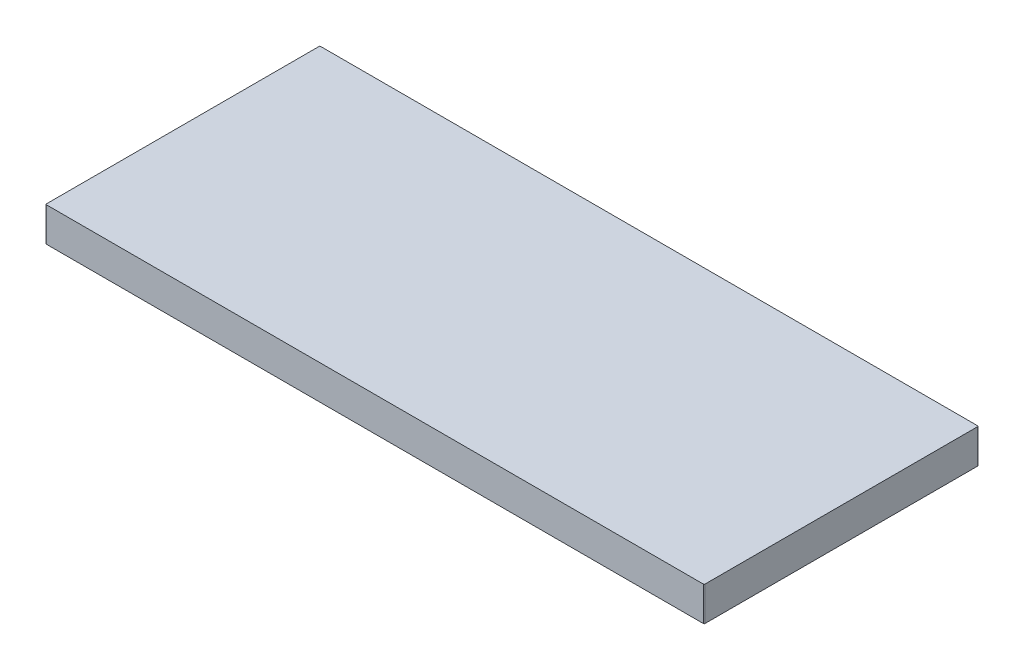
from build123d import *

# Parameters (mm, degrees)
BOSS_EXTRUDE1_DEPTH = 5


with BuildPart() as part:
    # Sketch1 → Boss-Extrude1 (new body)
    with BuildSketch(Plane(origin=(0, 0, 0), x_dir=(1, 0, 0), z_dir=(0, 1, 0))):
        with BuildLine():
            Line((48.15, -19.95), (48.15, 19.95))
            ThreePointArc((48.15, 19.95), (48.120710678, 20.020710678), (48.05, 20.05))
            Line((48.05, 20.05), (-48.05, 20.05))
            ThreePointArc((-48.05, 20.05), (-48.120710678, 20.020710678), (-48.15, 19.95))
            Line((-48.15, 19.95), (-48.15, -19.95))
            ThreePointArc((-48.15, -19.95), (-48.120710678, -20.020710678), (-48.05, -20.05))
            Line((-48.05, -20.05), (48.05, -20.05))
            ThreePointArc((48.05, -20.05), (48.120710678, -20.020710678), (48.15, -19.95))
        make_face()
    extrude(amount=BOSS_EXTRUDE1_DEPTH)


solid = part.part
